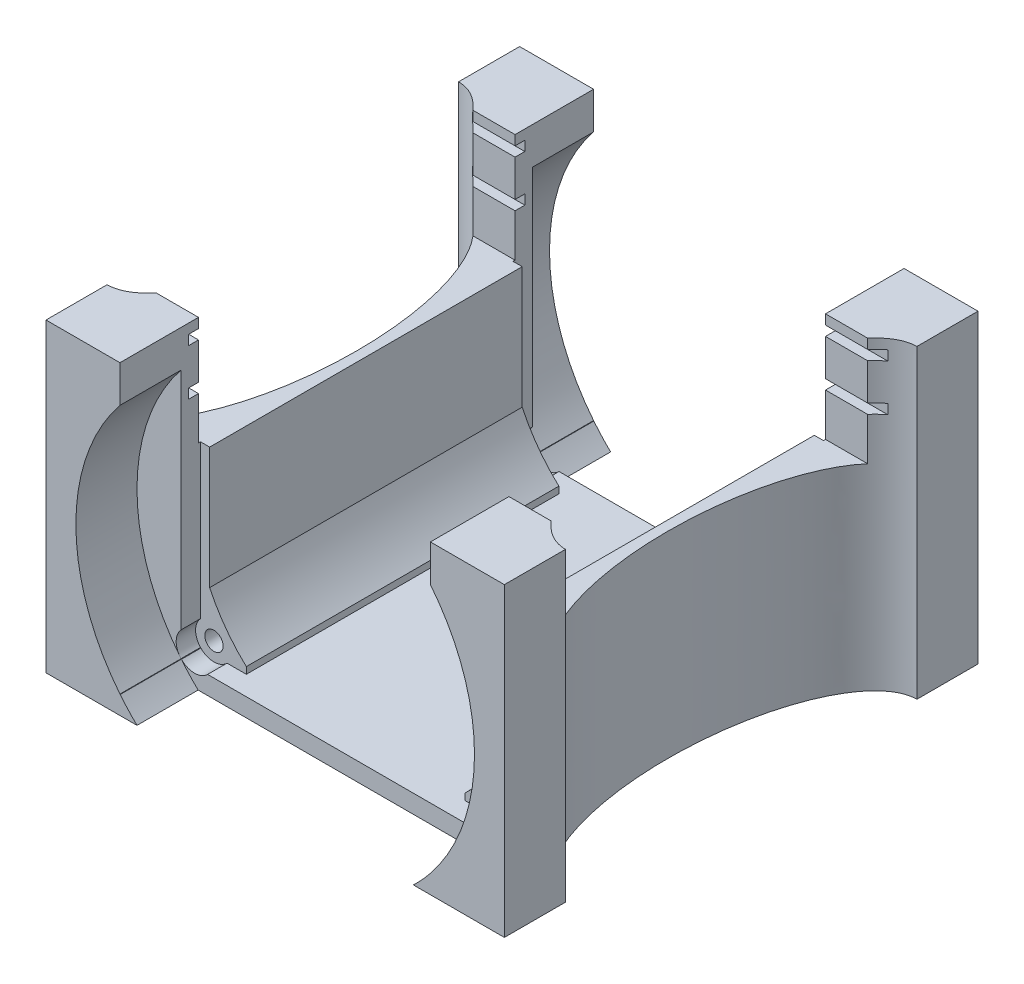
from build123d import *

# Parameters (mm, degrees)
ESBO_O1_W                = 75
ESBO_O1_H                = 57.5
RESSALTO_EXTRUS_O1_DEPTH = 50
ESBO_O2_W                = 47.8
ESBO_O2_H                = 47
CORTE_EXTRUS_O1_DEPTH    = 57.5
ESBO_O3_RX               = 28.75
ESBO_O3_RY               = 12
CORTE_EXTRUS_O2_DEPTH    = 50
ESBO_O4_W                = 50.8
ESBO_O4_H                = 3.18
CORTE_EXTRUS_O3_DEPTH    = 47
RESSALTO_EXTRUS_O3_DEPTH = 51.14
ESBO_O6_R                = 3
ESBO_O6_R_2              = 1.5
CORTE_EXTRUS_O4_DEPTH    = 3.18
CORTE_EXTRUS_O5_START    = -54.32
ESBO_O6_3_R              = 3
ESBO_O6_3_R_2            = 1.5
CORTE_EXTRUS_O5_DEPTH    = 3.18
ESBO_O6_6_R              = 1.5
CORTE_EXTRUS_O6_DEPTH    = 51.14
RESSALTO_EXTRUS_O4_DEPTH = 10
CORTE_EXTRUS_O7_REACH    = 100.115
ESBO_O8_W                = 51.8
ESBO_O8_H                = 6
ESBO_O8_W_2              = 55
ESBO_O8_H_2              = 1.6
ESBO_O8_H_3              = 7


with BuildPart() as part:
    # Esboço1 → Ressalto-extrusão1 (new body)
    with BuildSketch(Plane(origin=(0, 0, 0), x_dir=(1, 0, 0), z_dir=(0, 1, 0))):
        Rectangle(ESBO_O1_W, ESBO_O1_H)
    extrude(amount=RESSALTO_EXTRUS_O1_DEPTH)

    # Esboço2 → Corte-extrusão1 (cut)
    with BuildSketch(Plane.XY.offset(28.75)):
        with Locations((0, 26.5)):
            Rectangle(ESBO_O2_W, ESBO_O2_H)
    extrude(amount=-CORTE_EXTRUS_O1_DEPTH, mode=Mode.SUBTRACT)

    # Esboço3 → Corte-extrusão2 (cut)
    with BuildSketch(Plane(origin=(0, 50, 0), x_dir=(1, 0, 0), z_dir=(0, 1, 0))):
        with Locations(Location((-37.5, 0), (0, 0, -90))):
            Ellipse(ESBO_O3_RX, ESBO_O3_RY)
        with Locations(Location((37.5, 0), (0, 0, 90))):
            Ellipse(ESBO_O3_RX, ESBO_O3_RY)
    extrude(amount=-CORTE_EXTRUS_O2_DEPTH, mode=Mode.SUBTRACT)

    # Esboço4 → Corte-extrusão3 (cut)
    with BuildSketch(Plane(origin=(0, 50, 0), x_dir=(1, 0, 0), z_dir=(0, 1, 0))):
        with Locations((0, -27.16)):
            Rectangle(ESBO_O4_W, ESBO_O4_H)
        with Locations((0, 27.16)):
            Rectangle(ESBO_O4_W, ESBO_O4_H)
    extrude(amount=-CORTE_EXTRUS_O3_DEPTH, mode=Mode.SUBTRACT)

    # Esboço5 → Ressalto-extrusão3 (add)
    with BuildSketch(Plane.XY.offset(25.57)):
        with BuildLine():
            Line((-23.9, 12.286169254), (-23.9, 3))
            Line((-23.9, 3), (-17.9, 3))
            Line((-17.9, 3), (-17.9, 4.095103711))
            ThreePointArc((-17.9, 4.095103711), (-21.29749724, 7.899467595), (-23.9, 12.286169254))
        make_face()
        with BuildLine():
            Line((17.9, 4.095103711), (17.9, 3))
            Line((17.9, 3), (23.9, 3))
            Line((23.9, 3), (23.9, 12.286169254))
            ThreePointArc((23.9, 12.286169254), (21.29749724, 7.899467595), (17.9, 4.095103711))
        make_face()
    extrude(amount=-RESSALTO_EXTRUS_O3_DEPTH)

    # Esboço6 → Corte-extrusão4 (cut)
    # profile 1 of 2: a face of its own
    with BuildSketch(Plane.XY.offset(25.57)):
        with Locations((-23.2, 5.1)):
            Circle(ESBO_O6_R)
        with Locations((-23.2, 5.1)):
            Circle(ESBO_O6_R_2, mode=Mode.SUBTRACT)
    # profile 2 of 2: a face of its own
    with BuildSketch(Plane.XY.offset(25.57)):
        with Locations((23.2, 5.1)):
            Circle(ESBO_O6_R)
        with Locations((23.2, 5.1)):
            Circle(ESBO_O6_R_2, mode=Mode.SUBTRACT)
    extrude(amount=CORTE_EXTRUS_O4_DEPTH, mode=Mode.SUBTRACT)

    # Esboço6<3> → Corte-extrusão5 (cut)
    # profile 1 of 2: a face of its own
    with BuildSketch(Plane.XY.offset(25.57).offset(CORTE_EXTRUS_O5_START)):
        with Locations((-23.2, 5.1)):
            Circle(ESBO_O6_3_R)
        with Locations((-23.2, 5.1)):
            Circle(ESBO_O6_3_R_2, mode=Mode.SUBTRACT)
    # profile 2 of 2: a face of its own
    with BuildSketch(Plane.XY.offset(25.57).offset(CORTE_EXTRUS_O5_START)):
        with Locations((23.2, 5.1)):
            Circle(ESBO_O6_3_R)
        with Locations((23.2, 5.1)):
            Circle(ESBO_O6_3_R_2, mode=Mode.SUBTRACT)
    extrude(amount=CORTE_EXTRUS_O5_DEPTH, mode=Mode.SUBTRACT)

    # Esboço6<6> → Corte-extrusão6 (cut)
    with BuildSketch(Plane.XY.offset(25.57)):
        with Locations((-23.2, 5.1)):
            Circle(ESBO_O6_6_R)
        with Locations((23.2, 5.1)):
            Circle(ESBO_O6_6_R)
    extrude(amount=-CORTE_EXTRUS_O6_DEPTH, mode=Mode.SUBTRACT)

    # Esboço7 → Ressalto-extrusão4 (add)
    with BuildSketch(Plane.XY.offset(28.75)):
        with BuildLine():
            Line((-37.5, 0), (-22.610060881, 0))
            ThreePointArc((-22.610060881, 0), (-24.032727685, 1.457022591), (-25.3616808, 3))
            Line((-25.3616808, 3), (-25.4, 3))
            Line((-25.4, 3), (-25.4, 3.047497634))
            ThreePointArc((-25.4, 3.047497634), (-32.610808837, 23.5), (-25.4, 43.952502366))
            Line((-25.4, 43.952502366), (-25.4, 50))
            Line((-25.4, 50), (-37.5, 50))
            Line((-37.5, 50), (-37.5, 0))
        make_face()
        with BuildLine():
            Line((37.5, 0), (37.5, 50))
            Line((37.5, 50), (25.4, 50))
            Line((25.4, 50), (25.4, 43.952502366))
            ThreePointArc((25.4, 43.952502366), (30.755319845, 34.343207749), (32.610808837, 23.5))
            ThreePointArc((32.610808837, 23.5), (30.755319845, 12.656792251), (25.4, 3.047497634))
            Line((25.4, 3.047497634), (25.4, 3))
            Line((25.4, 3), (25.3616808, 3))
            ThreePointArc((25.3616808, 3), (24.032727685, 1.457022591), (22.610060881, 0))
            Line((22.610060881, 0), (37.5, 0))
        make_face()
    ressalto_extrus_o4 = extrude(amount=RESSALTO_EXTRUS_O4_DEPTH)

    # Espelhar1: Ressalto-extrusão4 across plane
    add(ressalto_extrus_o4.mirror(Plane.XY))

    # Corte-extrusão7: up to this face of the body (flat: up to its plane)
    corte_extrus_o7_end = Plane(part.part.faces().sort_by_distance((-37.5, 25, -33.75))[0])
    # Esboço8 → Corte-extrusão7 (cut, up to the picked face)
    with BuildSketch(Plane(origin=(37.5, 0, 0), x_dir=(0, 0, -1), z_dir=(1, 0, 0)), mode=Mode.PRIVATE) as corte_extrus_o7_sk1:
        with Locations((0, 43.8)):
            Rectangle(ESBO_O8_W, ESBO_O8_H)
    corte_extrus_o7_tool1 = split(extrude(corte_extrus_o7_sk1.sketch, amount=-CORTE_EXTRUS_O7_REACH, mode=Mode.PRIVATE), bisect_by=corte_extrus_o7_end, keep=Keep.BOTH, mode=Mode.PRIVATE)
    # Esboço8 → Corte-extrusão7 (cut, up to the picked face)
    with BuildSketch(Plane(origin=(37.5, 0, 0), x_dir=(0, 0, -1), z_dir=(1, 0, 0)), mode=Mode.PRIVATE) as corte_extrus_o7_sk2:
        with Locations((0, 40)):
            Rectangle(ESBO_O8_W_2, ESBO_O8_H_2)
    corte_extrus_o7_tool2 = split(extrude(corte_extrus_o7_sk2.sketch, amount=-CORTE_EXTRUS_O7_REACH, mode=Mode.PRIVATE), bisect_by=corte_extrus_o7_end, keep=Keep.BOTH, mode=Mode.PRIVATE)
    # Esboço8 → Corte-extrusão7 (cut, up to the picked face)
    with BuildSketch(Plane(origin=(37.5, 0, 0), x_dir=(0, 0, -1), z_dir=(1, 0, 0)), mode=Mode.PRIVATE) as corte_extrus_o7_sk3:
        with Locations((0, 35.7)):
            Rectangle(ESBO_O8_W, ESBO_O8_H_3)
    corte_extrus_o7_tool3 = split(extrude(corte_extrus_o7_sk3.sketch, amount=-CORTE_EXTRUS_O7_REACH, mode=Mode.PRIVATE), bisect_by=corte_extrus_o7_end, keep=Keep.BOTH, mode=Mode.PRIVATE)
    # Esboço8 → Corte-extrusão7 (cut, up to the picked face)
    with BuildSketch(Plane(origin=(37.5, 0, 0), x_dir=(0, 0, -1), z_dir=(1, 0, 0)), mode=Mode.PRIVATE) as corte_extrus_o7_sk4:
        with Locations((0, 47.6)):
            Rectangle(ESBO_O8_W_2, ESBO_O8_H_2)
    corte_extrus_o7_tool4 = split(extrude(corte_extrus_o7_sk4.sketch, amount=-CORTE_EXTRUS_O7_REACH, mode=Mode.PRIVATE), bisect_by=corte_extrus_o7_end, keep=Keep.BOTH, mode=Mode.PRIVATE)
    # Esboço8 → Corte-extrusão7 (cut, up to the picked face)
    with BuildSketch(Plane(origin=(37.5, 0, 0), x_dir=(0, 0, -1), z_dir=(1, 0, 0)), mode=Mode.PRIVATE) as corte_extrus_o7_sk5:
        with Locations((0, 49.2)):
            Rectangle(ESBO_O8_W, ESBO_O8_H_2)
    corte_extrus_o7_tool5 = split(extrude(corte_extrus_o7_sk5.sketch, amount=-CORTE_EXTRUS_O7_REACH, mode=Mode.PRIVATE), bisect_by=corte_extrus_o7_end, keep=Keep.BOTH, mode=Mode.PRIVATE)
    add(corte_extrus_o7_tool1.solids().sort_by(Axis((37.5, 43.8, 0), (-1, 0, 0)))[0], mode=Mode.SUBTRACT)
    add(corte_extrus_o7_tool2.solids().sort_by(Axis((37.5, 40, 0), (-1, 0, 0)))[0], mode=Mode.SUBTRACT)
    add(corte_extrus_o7_tool3.solids().sort_by(Axis((37.5, 35.7, 0), (-1, 0, 0)))[0], mode=Mode.SUBTRACT)
    add(corte_extrus_o7_tool4.solids().sort_by(Axis((37.5, 47.6, 0), (-1, 0, 0)))[0], mode=Mode.SUBTRACT)
    add(corte_extrus_o7_tool5.solids().sort_by(Axis((37.5, 49.2, 0), (-1, 0, 0)))[0], mode=Mode.SUBTRACT)


solid = part.part
